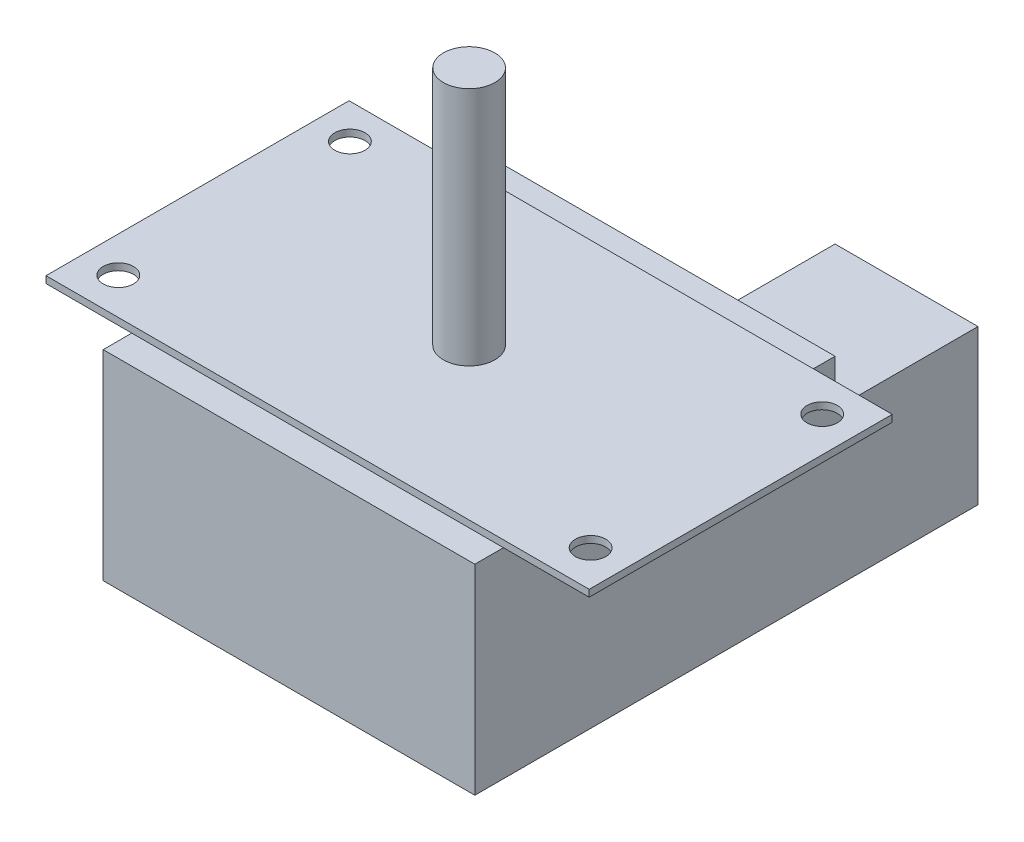
from build123d import *

# Parameters (mm, degrees)
SKETCH_1_W          = 95
SKETCH_1_H          = 53
EXTRUDE_282_DEPTH   = 1.2
EXTRUDE_686_DEPTH   = 35
SKETCH_10_W         = 25
SKETCH_10_H         = 25
CUT_EXTRUDE_1_DEPTH = 8
SKETCH_7_R          = 4.5
EXTRUDE_1043_DEPTH  = 42
HOLE_WIZARD_M5_1_D  = 5.3


with BuildPart() as part:
    # 草图1 → Extrude 282 (new body)
    with BuildSketch(Plane(origin=(0, 0, 0), x_dir=(1, 0, 0), z_dir=(0, 1, 0))):
        Rectangle(SKETCH_1_W, SKETCH_1_H)
    extrude(amount=EXTRUDE_282_DEPTH)

    # 草图6 → Extrude 686 (add)
    with BuildSketch(Plane.XZ):
        Polygon((32.5, -56.5), (7.5, -56.5), (7.5, -31.5), (-32.5, -31.5), (-32.5, 31.5), (32.5, 31.5), align=None)
    extrude(amount=EXTRUDE_686_DEPTH)

    # 草图10 → 切除-拉伸1 (cut)
    with BuildSketch(Plane(origin=(0, 0, 0), x_dir=(1, 0, 0), z_dir=(0, 1, 0))):
        with Locations((20, 44)):
            Rectangle(SKETCH_10_W, SKETCH_10_H)
    extrude(amount=-CUT_EXTRUDE_1_DEPTH, mode=Mode.SUBTRACT)

    # 草图7 → Extrude 1043 (add)
    with BuildSketch(Plane(origin=(0, 1.2, 0), x_dir=(1, 0, 0), z_dir=(0, 1, 0))):
        with Locations(Location((0, 0, 0), (0, 0, 90))):
            Circle(SKETCH_7_R)
    extrude(amount=EXTRUDE_1043_DEPTH)

    # M5 间隙孔1 (through all)
    with Locations(Plane(origin=(0, 1.2, 0), x_dir=(1, 0, 0), z_dir=(0, 1, 0))):
        with Locations((-41.25, 20.4), (-41.25, -20.1), (41.35, -20.1), (41.35, 20.4)):
            Hole(HOLE_WIZARD_M5_1_D / 2)


solid = part.part
